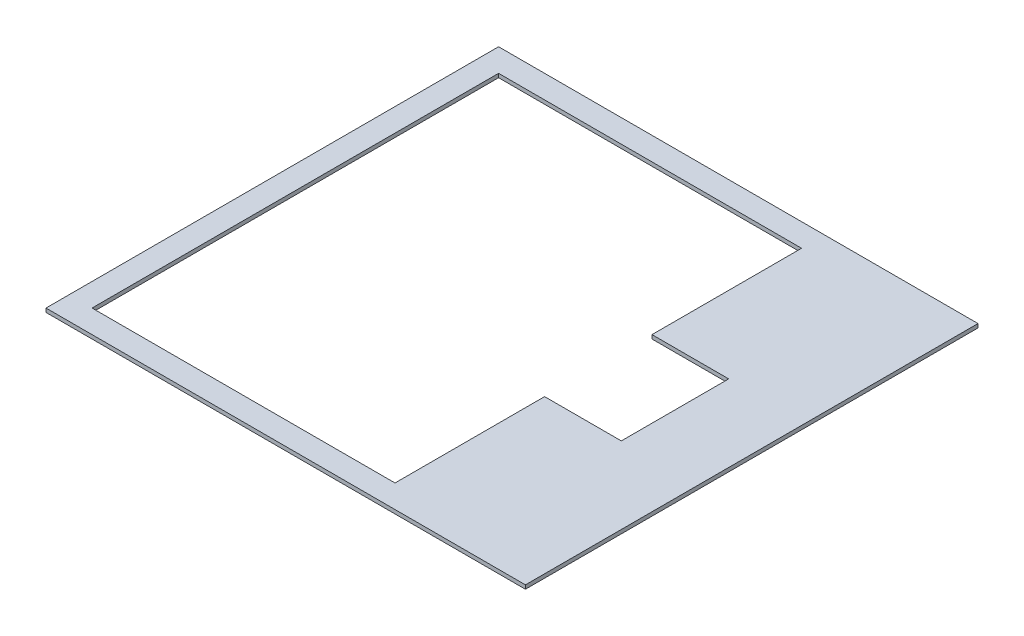
from build123d import *

# Parameters (mm, degrees)
SKETCH1_W           = 625
SKETCH1_H           = 590
BOSS_EXTRUDE1_DEPTH = 5
SKETCH2_W           = 395
SKETCH2_H           = 530
CUT_EXTRUDE1_DEPTH  = 23.4
CUT_EXTRUDE2_DEPTH  = 23.4


with BuildPart() as part:
    # Sketch1 → Boss-Extrude1 (new body)
    with BuildSketch(Plane(origin=(0, 0, 0), x_dir=(1, 0, 0), z_dir=(0, 1, 0))):
        Rectangle(SKETCH1_W, SKETCH1_H)
    extrude(amount=BOSS_EXTRUDE1_DEPTH)

    # Sketch2 → Cut-Extrude1 (cut)
    with BuildSketch(Plane(origin=(0, 5, 0), x_dir=(1, 0, 0), z_dir=(0, 1, 0))):
        with Locations((-85, 0)):
            Rectangle(SKETCH2_W, SKETCH2_H)
    extrude(amount=-CUT_EXTRUDE1_DEPTH, mode=Mode.SUBTRACT)

    # Sketch3 → Cut-Extrude2 (cut)
    with BuildSketch(Plane(origin=(0, 5, 0), x_dir=(1, 0, 0), z_dir=(0, 1, 0))):
        Polygon((112.5, 70), (112.5, 0), (112.5, -70), (212.5, -70), (212.5, 70), align=None)
    extrude(amount=-CUT_EXTRUDE2_DEPTH, mode=Mode.SUBTRACT)


solid = part.part
